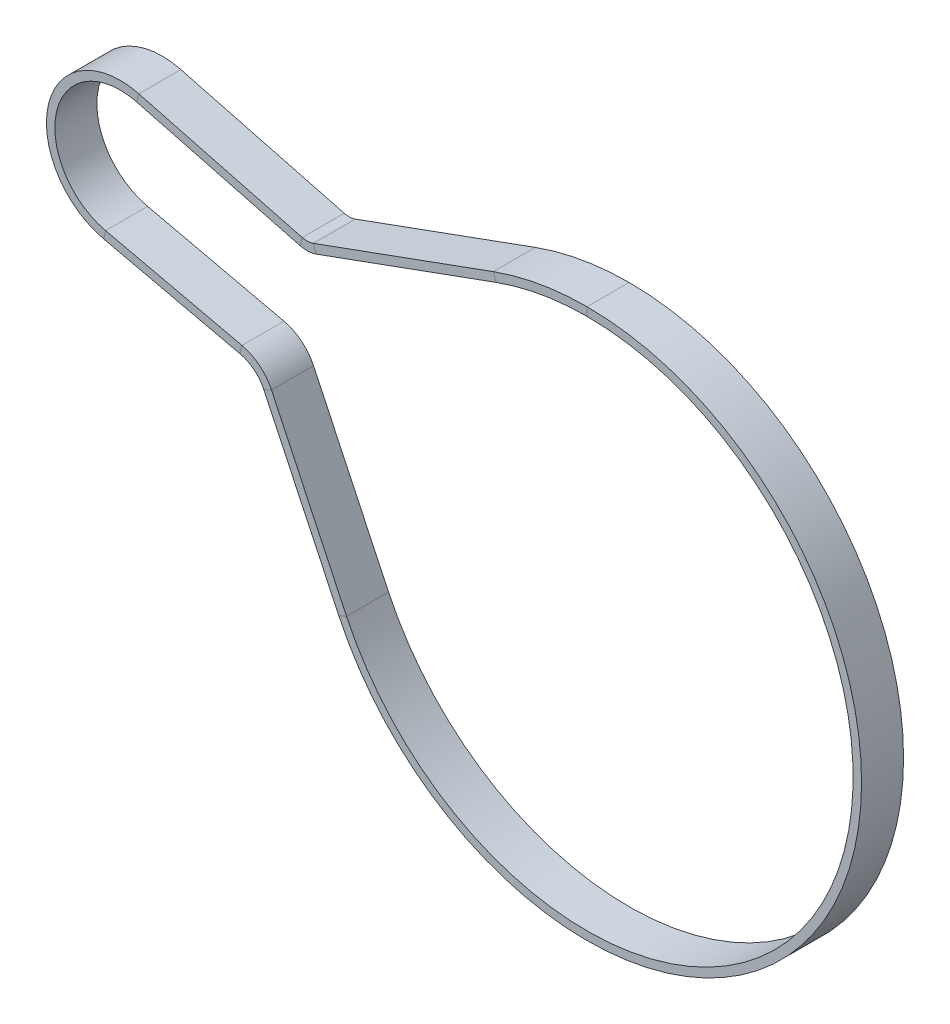
from build123d import *

# Parameters (mm, degrees)
SKETCH3_W = 9
SKETCH3_H = 1.8


with BuildPart() as part:
    # Sweep1: sweep along a path in Sketch2
    with BuildLine(Plane.XY) as sweep1_path:
        Line((-19.485510265, 53.565986313), (-58.017263868, 39.549425954))
        ThreePointArc((-58.017263868, 39.549425954), (-59.730517516, 39.206263797), (-61.468228048, 39.388912191))
        Line((-61.468228048, 39.388912191), (-96.456001264, 48.544005056))
        ThreePointArc((-96.456001264, 48.544005056), (-113.596401609, 38.337343746), (-103.129914839, 21.354354794))
        Line((-103.129914839, 21.354354794), (-73.920842285, 14.654641571))
        ThreePointArc((-73.920842285, 14.654641571), (-70.173470914, 12.838590034), (-67.594291029, 9.569237421))
        Line((-67.594291029, 9.569237421), (-51.518861434, -24.38866369))
        ThreePointArc((-51.518861434, -24.38866369), (52.72226346, -21.664785612), (-19.485510265, 53.565986313))
    # Sketch3 → Sweep1 (sweep)
    with BuildSketch(Plane(origin=(0, 0, 0), x_dir=(0, 0, -1), z_dir=(1, 0, 0))):
        with Locations((0, 57.9)):
            Rectangle(SKETCH3_W, SKETCH3_H)
    sweep(path=sweep1_path.line)


solid = part.part
